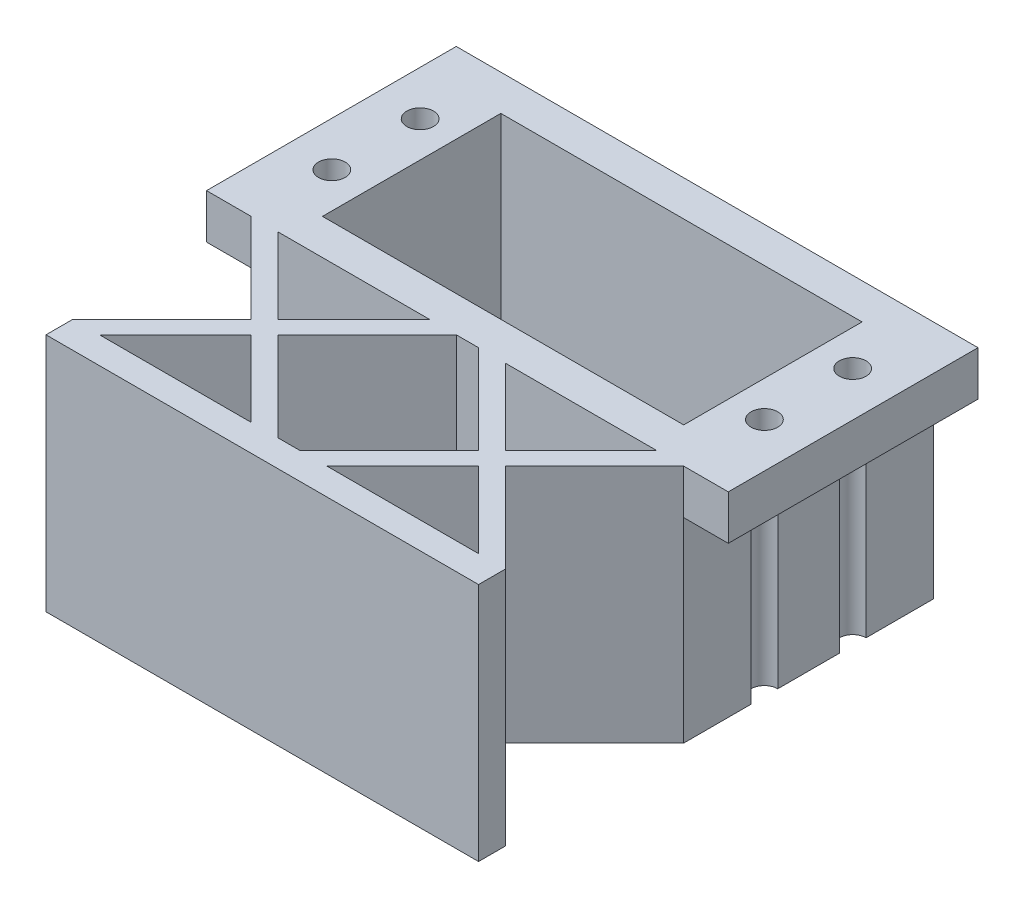
from build123d import *
from build123d.topology import SkipClean

# Parameters (mm, degrees)
SKETCH1_W           = 40.5
SKETCH1_H           = 20
BOSS_EXTRUDE1_DEPTH = 26.9
BOSS_EXTRUDE2_DEPTH = 5
SKETCH3_R           = 1.5
CUT_EXTRUDE1_DEPTH  = 67.10491661


with BuildPart() as part:
    # Sketch1 → Boss-Extrude1 (new body)
    with BuildSketch(Plane(origin=(0, 0, 0), x_dir=(1, 0, 0), z_dir=(0, 1, 0))):
        Polygon((0, 0), (0, 28), (48.5, 28), (48.5, 0), (38.5, -10), (48.5, -20), (48.5, -23), (0, -23), (0, -20), (10, -10), align=None)
        with Locations((24.25, 14)):
            Rectangle(SKETCH1_W, SKETCH1_H, mode=Mode.SUBTRACT)
        Polygon((3, 0), (20, 0), (11.5, -8.5), align=None, mode=Mode.SUBTRACT)
        Polygon((13, -10), (23, 0), (25.5, 0), (35.5, -10), (25.5, -20), (23, -20), align=None, mode=Mode.SUBTRACT)
        Polygon((11.5, -11.5), (3, -20), (20, -20), align=None, mode=Mode.SUBTRACT)
        Polygon((45.5, 0), (28.5, 0), (37, -8.5), align=None, mode=Mode.SUBTRACT)
        Polygon((37, -11.5), (28.5, -20), (45.5, -20), align=None, mode=Mode.SUBTRACT)
    extrude(amount=BOSS_EXTRUDE1_DEPTH)

    # Sketch2 → Boss-Extrude2 (add)
    with BuildSketch(Plane(origin=(0, 26.9, 0), x_dir=(1, 0, 0), z_dir=(0, 1, 0))):
        with BuildLine():
            Line((-5, 0), (0, 0))
            Line((0, 0), (0, 7.55))
            ThreePointArc((0, 7.55), (-1.5, 9.05), (0, 10.55))
            Line((0, 10.55), (0, 17.45))
            ThreePointArc((0, 17.45), (-1.5, 18.95), (0, 20.45))
            Line((0, 20.45), (0, 28))
            Line((0, 28), (-5, 28))
            Line((-5, 28), (-5, 0))
        make_face()
        with BuildLine():
            Line((53.5, 28), (48.5, 28))
            Line((48.5, 28), (48.5, 20.45))
            ThreePointArc((48.5, 20.45), (50, 18.95), (48.5, 17.45))
            Line((48.5, 17.45), (48.5, 10.55))
            ThreePointArc((48.5, 10.55), (50, 9.05), (48.5, 7.55))
            Line((48.5, 7.55), (48.5, 0))
            Line((48.5, 0), (53.5, 0))
            Line((53.5, 0), (53.5, 28))
        make_face()
    extrude(amount=-BOSS_EXTRUDE2_DEPTH)

    # Sketch3 → Cut-Extrude1 (cut, through all)
    with SkipClean():  # the faces are left unmerged after this step: merging them gives an invalid solid
        with BuildSketch(Plane(origin=(0, 26.9, 0), x_dir=(1, 0, 0), z_dir=(0, 1, 0))):
            with Locations(Location((0, 18.95, 0), (0, 0, 270))):
                Circle(SKETCH3_R)
            with Locations(Location((0, 9.05, 0), (0, 0, 270))):
                Circle(SKETCH3_R)
            with Locations(Location((48.5, 9.05, 0), (0, 0, 270))):
                Circle(SKETCH3_R)
            with Locations(Location((48.5, 18.95, 0), (0, 0, 270))):
                Circle(SKETCH3_R)
        extrude(amount=-CUT_EXTRUDE1_DEPTH, mode=Mode.SUBTRACT)


solid = part.part
